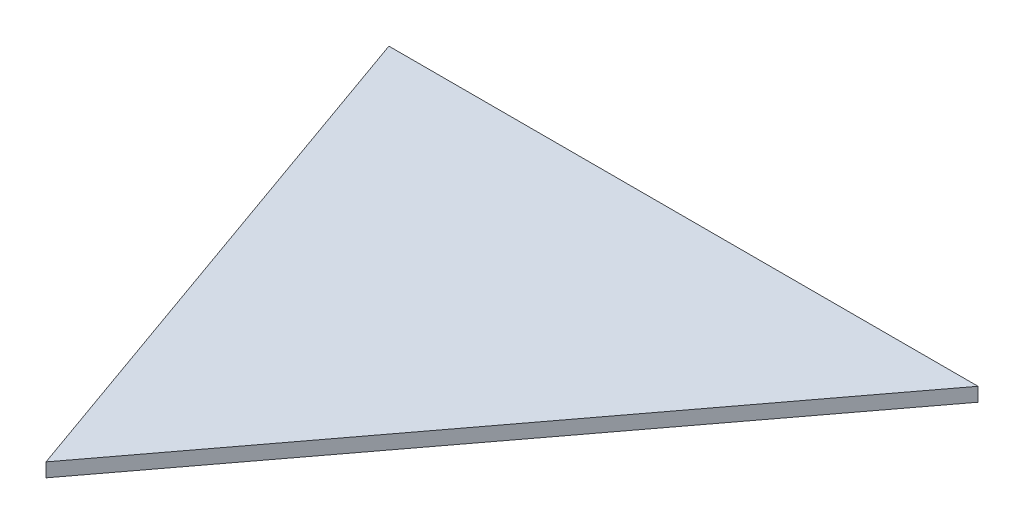
from build123d import *

# Parameters (mm, degrees)
BOSS_EXTRUDE1_DEPTH = 152.4
SKETCH3_OUTSIDE_W   = 273.93
SKETCH3_OUTSIDE_H   = 229.576
CUT_EXTRUDE2_DEPTH  = 381.660734008
SHELL1_T            = -6.35
CUT_EXTRUDE3_DEPTH  = 381.660734008


with BuildPart() as part:
    # Sketch2 → Boss-Extrude1 (new body)
    with BuildSketch(Plane(origin=(0, 0, 0), x_dir=(1, 0, 0), z_dir=(0, 1, 0))):
        Polygon((-57.15, 0), (224.536, 0), (-24.357683353, -196.753899884), align=None)
    extrude(amount=BOSS_EXTRUDE1_DEPTH)

    # Sketch3 outside → Cut-Extrude2 (cut, through all)
    with BuildSketch(Plane(origin=(-63.5, 0, 0), x_dir=(0, 0, -1), z_dir=(1, 0, 0))):
        with Locations((-98.377, 76.2)):
            Rectangle(SKETCH3_OUTSIDE_W, SKETCH3_OUTSIDE_H)
        Polygon((0, 152.4), (-152.4, 107.95), (-261.257142857, 76.2), (-152.4, 44.45), (0, 0), align=None, mode=Mode.SUBTRACT)
    extrude(amount=CUT_EXTRUDE2_DEPTH, mode=Mode.SUBTRACT)

    # Shell1
    shell1_openings = [part.faces().sort_by_distance(p)[0] for p in [
        (83.693, 76.2, 0),
    ]]
    offset(amount=SHELL1_T, openings=shell1_openings, kind=Kind.INTERSECTION)

    # Sketch4 → Cut-Extrude3 (cut, through all)
    with BuildSketch(Plane(origin=(-63.5, 0, 0), x_dir=(0, 0, -1), z_dir=(1, 0, 0))):
        Polygon((0, 145.785416667), (-196.753899884, 88.398862534), (-196.753899884, -13.199062294), (0, -70.585616426), align=None)
    extrude(amount=CUT_EXTRUDE3_DEPTH, mode=Mode.SUBTRACT)


solid = part.part
